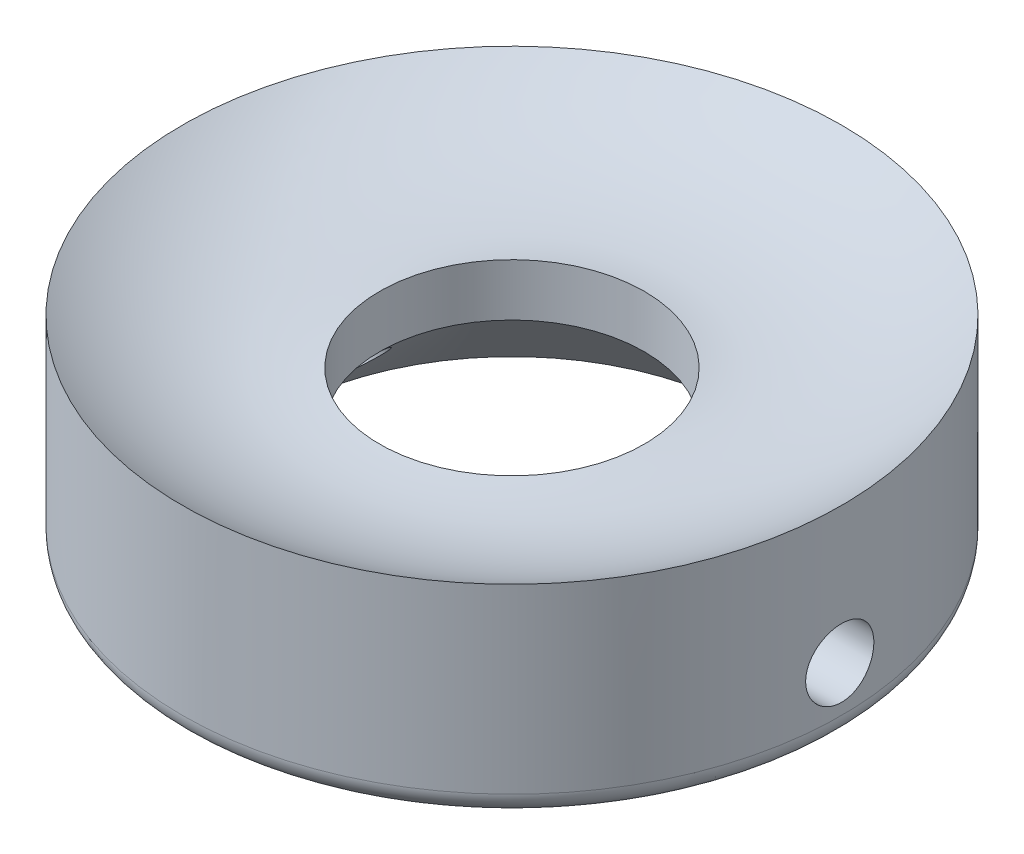
from build123d import *

# Parameters (mm, degrees)
SKETCH1_R               = 36.83
BOSS_EXTRUDE1_DEPTH     = 22.86
FILLET1_R               = 2.54
SKETCH2_R               = 26.67
SKETCH3_R               = 14.7955
SKETCH4_R               = 14.7955
CUT_EXTRUDE1_DEPTH      = 76.2
SKETCH18_R              = 3.175
CUT_EXTRUDE2_DEPTH      = 6.35
CUT_EXTRUDE3_DEPTH      = 6.35
CUT_EXTRUDE4_START      = 2.54
CUT_EXTRUDE4_DEPTH      = 2.54
CIRPATTERN1_COUNT       = 2
CUT_EXTRUDE5_DEPTH      = 57.881257188
CUT_EXTRUDE5_DEPTH_BACK = 57.881257188
SKETCH22_R              = 3.81


with BuildPart() as part:
    # Sketch1 → Boss-Extrude1 (new body)
    with BuildSketch(Plane(origin=(0, 0, 0), x_dir=(1, 0, 0), z_dir=(0, 1, 0))):
        with Locations(Location((0, 0, 0), (0, 0, 270))):
            Circle(SKETCH1_R)
    extrude(amount=BOSS_EXTRUDE1_DEPTH)

    # Fillet1
    fillet1_edges = [part.edges().sort_by_distance(p)[0] for p in [
        (0, 0, -36.83),
    ]]
    fillet(fillet1_edges, radius=FILLET1_R)

    # Sketch2 → Cut-Loft1 section 0
    with BuildSketch(Plane(origin=(0, 0, 0), x_dir=(1, 0, 0), z_dir=(0, 1, 0))):
        Circle(SKETCH2_R)
    # Sketch3 → Cut-Loft1 section 1
    with BuildSketch(Plane(origin=(0, 11.938, 0), x_dir=(1, 0, 0), z_dir=(0, 1, 0))):
        Circle(SKETCH3_R)
    loft(mode=Mode.SUBTRACT)

    # Sketch4 → Cut-Extrude1 (cut)
    with BuildSketch(Plane.XZ.offset(-11.938)):
        with Locations(Location((0, 0, 0), (0, 0, 270))):
            Circle(SKETCH4_R)
    extrude(amount=-CUT_EXTRUDE1_DEPTH, mode=Mode.SUBTRACT)

    # Sketch17 → Cut-Revolve1 (revolve, cut)
    with BuildSketch(Plane(origin=(0, 0, 0), x_dir=(0, 0, -1), z_dir=(1, 0, 0))):
        with BuildLine():
            Line((36.83, 22.86), (14.7955, 22.86))
            Line((14.7955, 22.86), (14.7955, 17.78))
            ThreePointArc((14.7955, 17.78), (26.280325712, 18.29189035), (36.83, 22.86))
        make_face()
    revolve(axis=Axis((0, 0, 0), (0, 1, 0)), mode=Mode.SUBTRACT)

    # Sketch18 → Cut-Extrude2 (cut)
    with BuildSketch(Plane.XZ):
        with Locations(Location((0, 30.431156816, 0), (0, 0, 270))):
            Circle(SKETCH18_R)
        with Locations(Location((0, -30.431156816, 0), (0, 0, 270))):
            Circle(SKETCH18_R)
    extrude(amount=-CUT_EXTRUDE2_DEPTH, mode=Mode.SUBTRACT)

    # Sketch19 → Cut-Extrude3 (cut)
    with BuildSketch(Plane.XZ):
        with BuildLine():
            Line((4.259709497, -31.701156816), (2.909935566, -31.701156816))
            ThreePointArc((2.909935566, -31.701156816), (3.175, -30.431156816), (2.909935566, -29.161156816))
            Line((2.909935566, -29.161156816), (4.259709497, -29.161156816))
            ThreePointArc((4.259709497, -29.161156816), (4.445, -30.431156816), (4.259709497, -31.701156816))
        make_face()
    cut_extrude3 = extrude(amount=-CUT_EXTRUDE3_DEPTH, mode=Mode.SUBTRACT)

    # Sketch20 → Cut-Extrude4 (cut)
    with BuildSketch(Plane.XZ.offset(-6.35).offset(CUT_EXTRUDE4_START)):
        with BuildLine():
            Line((-1.27, -34.690866313), (-1.27, -33.341092382))
            ThreePointArc((-1.27, -33.341092382), (1.15960956, -33.3868176), (2.909935566, -31.701156816))
            Line((2.909935566, -31.701156816), (4.259709497, -31.701156816))
            ThreePointArc((4.259709497, -31.701156816), (2.114043859, -34.341251899), (-1.27, -34.690866313))
        make_face()
    cut_extrude4 = extrude(amount=-CUT_EXTRUDE4_DEPTH, mode=Mode.SUBTRACT)

    # CirPattern1: Cut-Extrude3, Cut-Extrude4 ×2 about axis
    cirpattern1_axis = Axis((0, 0, 0), (0, 1, 0))
    add([cut_extrude3.rotate(cirpattern1_axis, i * 360 / CIRPATTERN1_COUNT) for i in range(1, CIRPATTERN1_COUNT)], mode=Mode.SUBTRACT)
    add([cut_extrude4.rotate(cirpattern1_axis, i * 360 / CIRPATTERN1_COUNT) for i in range(1, CIRPATTERN1_COUNT)], mode=Mode.SUBTRACT)

    # Sketch22 → Cut-Extrude5 (cut, two sides: drawn at the far end of the back side and taken through both)
    with BuildSketch(Plane(origin=(0, 0, 0), x_dir=(0, 0, -1), z_dir=(1, 0, 0)).offset(-CUT_EXTRUDE5_DEPTH_BACK)):
        with Locations((0, 7.62)):
            Circle(SKETCH22_R)
    extrude(amount=CUT_EXTRUDE5_DEPTH + CUT_EXTRUDE5_DEPTH_BACK, mode=Mode.SUBTRACT)


solid = part.part
